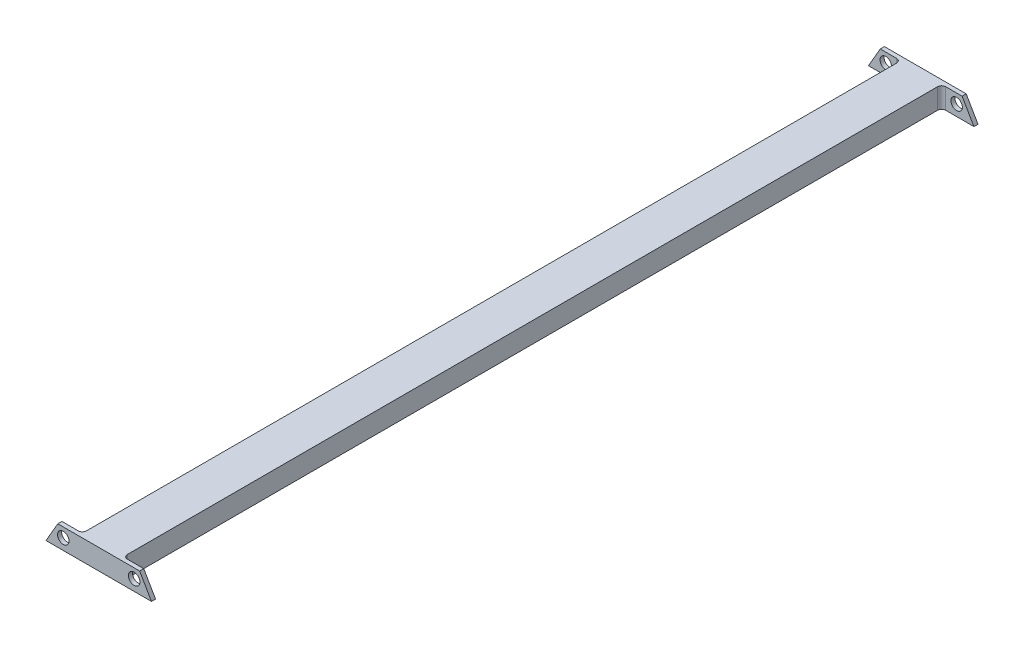
from build123d import *

# Parameters (mm, degrees)
SZKIC1_R                    = 7
DODANIE_WYCI_GNI_CIE1_DEPTH = 5
SZKIC2_W                    = 50
SZKIC2_H                    = 25
DODANIE_WYCI_GNI_CIE2_DEPTH = 1000
SZKIC3_R                    = 7
DODANIE_WYCI_GNI_CIE3_DEPTH = 5
ZAOKR_GLENIE1_R             = 5
ZAOKR_GLENIE2_R             = 5
ZAOKR_GLENIE3_R             = 5
ZAOKR_GLENIE4_R             = 5


with BuildPart() as part:
    # Szkic1 → Dodanie-wyciągnięcie1 (new body)
    with BuildSketch(Plane.XY):
        Polygon((0, 0), (100, 0), (114.43375673, -25), (-14.43375673, -25), align=None)
        with Locations((93.301270189, -11.602540378)):
            Circle(SZKIC1_R, mode=Mode.SUBTRACT)
        with Locations((6.698729811, -11.602540378)):
            Circle(SZKIC1_R, mode=Mode.SUBTRACT)
    extrude(amount=DODANIE_WYCI_GNI_CIE1_DEPTH)

    # Szkic2 → Dodanie-wyciągnięcie2 (add)
    with BuildSketch(Plane.XY.offset(5)):
        with Locations((50, -12.5)):
            Rectangle(SZKIC2_W, SZKIC2_H)
    extrude(amount=DODANIE_WYCI_GNI_CIE2_DEPTH)

    # Szkic3 → Dodanie-wyciągnięcie3 (add)
    with BuildSketch(Plane.XY.offset(1005)):
        Polygon((-14.43375673, -25), (25, -25), (75, -25), (114.43375673, -25), (100, 0), (75, 0), (25, 0), (0, 0), align=None)
        with Locations((93.301270189, -11.602540378)):
            Circle(SZKIC3_R, mode=Mode.SUBTRACT)
        with Locations((6.698729811, -11.602540378)):
            Circle(SZKIC3_R, mode=Mode.SUBTRACT)
    extrude(amount=DODANIE_WYCI_GNI_CIE3_DEPTH)

    # Zaokrąglenie1
    zaokr_glenie1_edges = [part.edges().sort_by_distance(p)[0] for p in [
        (25, -12.5, 5),
    ]]
    fillet(zaokr_glenie1_edges, radius=ZAOKR_GLENIE1_R)

    # Zaokrąglenie2
    zaokr_glenie2_edges = [part.edges().sort_by_distance(p)[0] for p in [
        (75, -12.5, 5),
    ]]
    fillet(zaokr_glenie2_edges, radius=ZAOKR_GLENIE2_R)

    # Zaokrąglenie3
    zaokr_glenie3_edges = [part.edges().sort_by_distance(p)[0] for p in [
        (75, -12.5, 1005),
    ]]
    fillet(zaokr_glenie3_edges, radius=ZAOKR_GLENIE3_R)

    # Zaokrąglenie4
    zaokr_glenie4_edges = [part.edges().sort_by_distance(p)[0] for p in [
        (25, -12.5, 1005),
    ]]
    fillet(zaokr_glenie4_edges, radius=ZAOKR_GLENIE4_R)


solid = part.part
